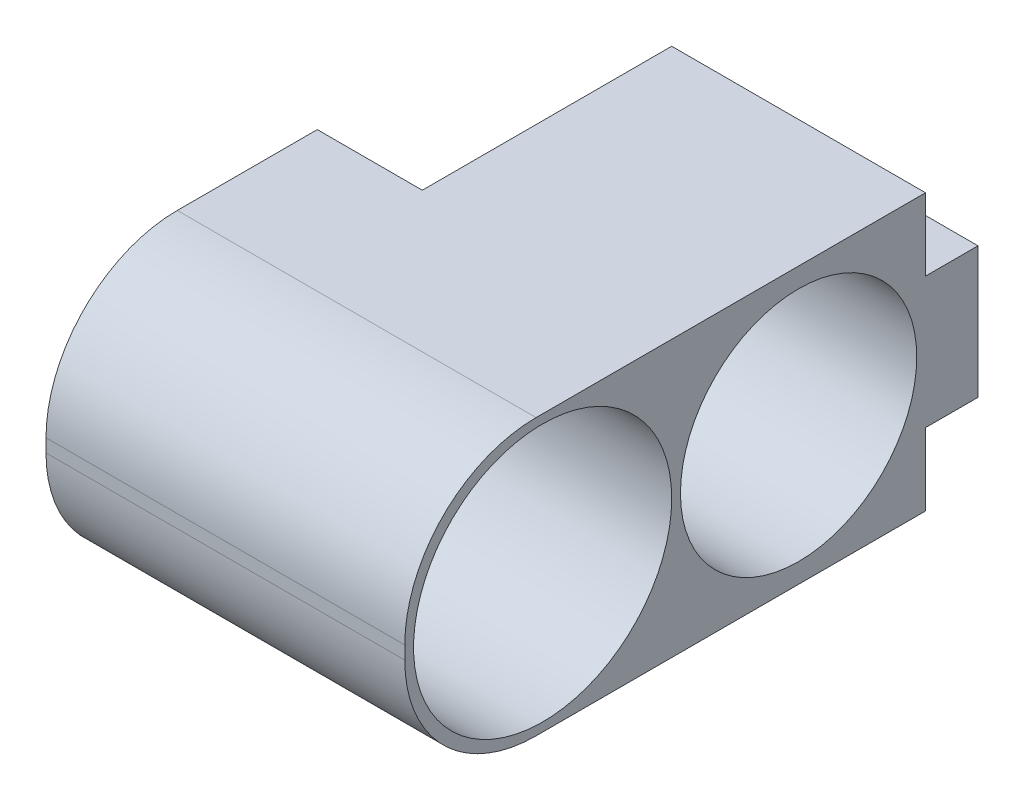
from build123d import *

# Parameters (mm, degrees)
SKETCH_1_W          = 6.3
SKETCH_1_H          = 11.9
SKETCH_1_W_2        = 3
SKETCH_1_H_2        = 1.2
EXTRUDE_2_DEPTH     = 3
SKETCH_7_W          = 6.3
SKETCH_7_H          = 5.7
EXTRUDE_4_DEPTH     = 2.8
SKETCH_8_W          = 6.3
SKETCH_8_H          = 6.2
EXTRUDE_5_DEPTH     = 5.2
SKETCH_5_R          = 2.7
SKETCH_5_R_2        = 2.95
CUT_EXTRUDE_3_DEPTH = 15.790960077
FILLET_1_R          = 3


with BuildPart() as part:
    # ｽｹｯﾁ1 → ﾎﾞｽ - 押し出し2 (new body)
    with BuildSketch(Plane.YZ):
        with Locations((0, 5.95)):
            Rectangle(SKETCH_1_W, SKETCH_1_H)
        with Locations((0, -0.6)):
            Rectangle(SKETCH_1_W_2, SKETCH_1_H_2)
    extrude(amount=-EXTRUDE_2_DEPTH)

    # ｽｹｯﾁ7 → ﾎﾞｽ - 押し出し4 (add)
    with BuildSketch(Plane(origin=(-3, 0, 0), x_dir=(0, -1, 0), z_dir=(-1, 0, 0))):
        with Locations((0, 2.85)):
            Rectangle(SKETCH_7_W, SKETCH_7_H)
    extrude(amount=EXTRUDE_4_DEPTH)

    # ｽｹｯﾁ8 → ﾎﾞｽ - 押し出し5 (add)
    with BuildSketch(Plane(origin=(-3, 0, 0), x_dir=(0, -1, 0), z_dir=(-1, 0, 0))):
        with Locations((0, 8.8)):
            Rectangle(SKETCH_8_W, SKETCH_8_H)
    extrude(amount=EXTRUDE_5_DEPTH)

    # ｽｹｯﾁ5 → ｶｯﾄ - 押し出し3 (cut, through all)
    with BuildSketch(Plane.YZ):
        with Locations(Location((0, 2.9, 0), (0, 0, 270))):
            Circle(SKETCH_5_R)
        with Locations(Location((0, 8.75, 0), (0, 0, 270))):
            Circle(SKETCH_5_R_2)
    extrude(amount=-CUT_EXTRUDE_3_DEPTH, mode=Mode.SUBTRACT)

    # ﾌｨﾚｯﾄ1
    fillet_1_edges = [part.edges().sort_by_distance(p)[0] for p in [
        (-4.1, -3.15, 11.9),
        (-4.1, 3.15, 11.9),
    ]]
    fillet(fillet_1_edges, radius=FILLET_1_R)


solid = part.part
